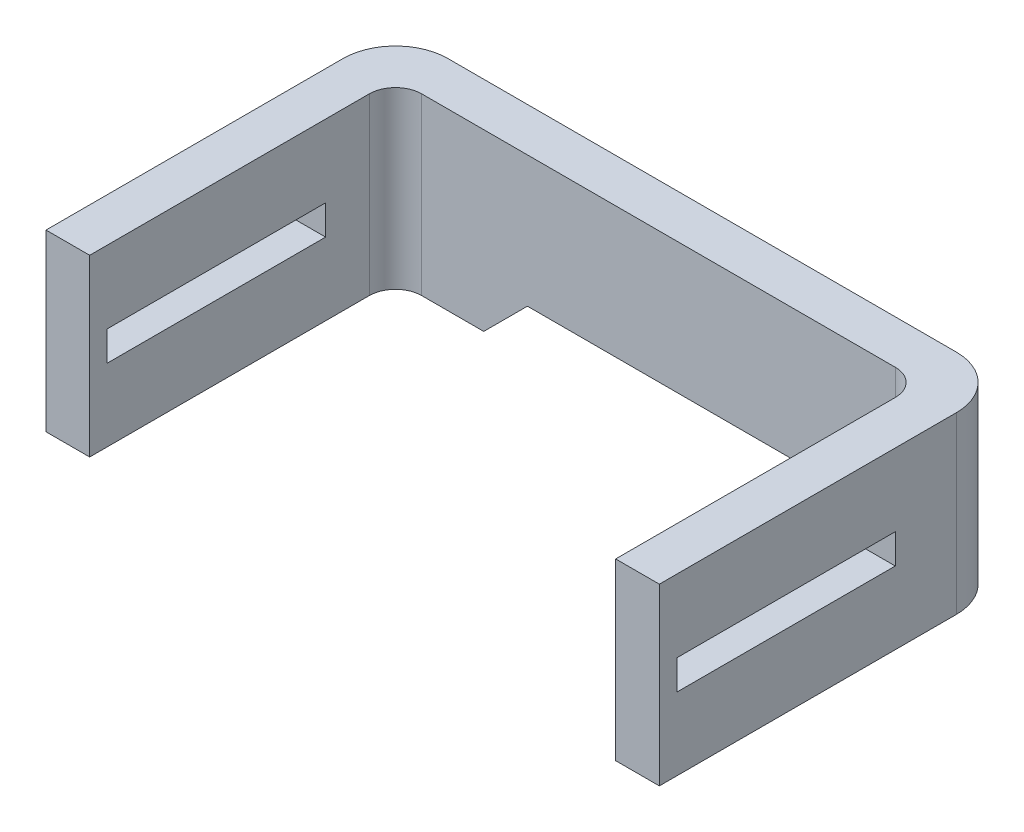
from build123d import *

# Parameters (mm, degrees)
AUFSATZ_LINEAR_AUSTRAGEN1_DEPTH = 20
SKIZZE2_W                       = 25
SKIZZE2_H                       = 3.4
SCHNITT_LINEAR_AUSTRAGEN1_DEPTH = 84.234848471
VERRUNDUNG1_R                   = 3
VERRUNDUNG2_R                   = 6
SCHNITT_LINEAR_AUSTRAGEN2_DEPTH = 80.063518768


with BuildPart() as part:
    # Skizze1 → Aufsatz-Linear austragen1 (new body)
    with BuildSketch(Plane(origin=(0, 0, 0), x_dir=(1, 0, 0), z_dir=(0, 1, 0))):
        Polygon((0, 0), (0, 35), (60.2, 35), (60.2, 0), (65.2, 0), (65.2, 40), (-5, 40), (-5, 0), align=None)
    extrude(amount=AUFSATZ_LINEAR_AUSTRAGEN1_DEPTH)

    # Skizze2 → Schnitt-Linear austragen1 (cut, through all)
    with BuildSketch(Plane.ZY.offset(5)):
        with Locations((-14.5, 10)):
            Rectangle(SKIZZE2_W, SKIZZE2_H)
    extrude(amount=-SCHNITT_LINEAR_AUSTRAGEN1_DEPTH, mode=Mode.SUBTRACT)

    # Verrundung1
    verrundung1_edges = [part.edges().sort_by_distance(p)[0] for p in [
        (60.2, 10, -35),
        (0, 10, -35),
    ]]
    fillet(verrundung1_edges, radius=VERRUNDUNG1_R)

    # Verrundung2
    verrundung2_edges = [part.edges().sort_by_distance(p)[0] for p in [
        (-5, 10, -40),
        (65.2, 10, -40),
    ]]
    fillet(verrundung2_edges, radius=VERRUNDUNG2_R)

    # Skizze3 → Schnitt-Linear austragen2 (cut, through all)
    with BuildSketch(Plane(origin=(0, 0, -40), x_dir=(-1, 0, 0), z_dir=(0, 0, -1))):
        Polygon((-45.1, 5), (-15.1, 5), (-10.1, 0), (-50.1, 0), align=None)
    extrude(amount=-SCHNITT_LINEAR_AUSTRAGEN2_DEPTH, mode=Mode.SUBTRACT)


solid = part.part
